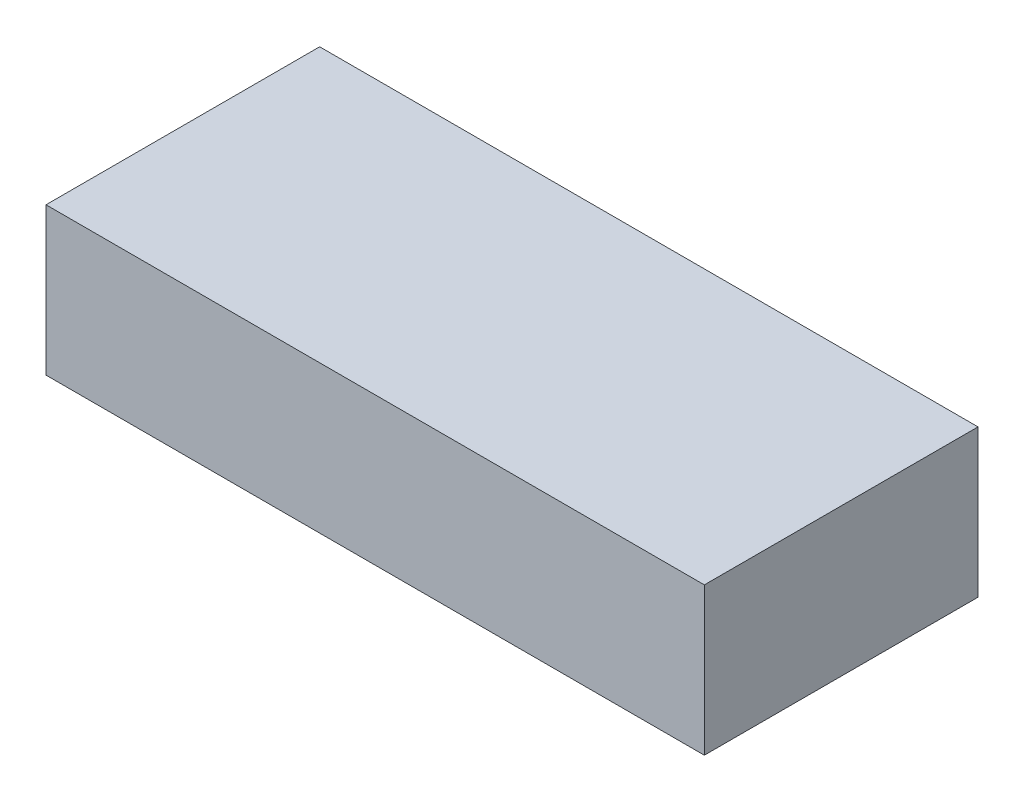
from build123d import *

# Parameters (mm, degrees)
SKETCH1_W           = 83
SKETCH1_H           = 34.5
BOSS_EXTRUDE1_DEPTH = 18.6


with BuildPart() as part:
    # Sketch1 → Boss-Extrude1 (new body)
    with BuildSketch(Plane(origin=(0, 0, 0), x_dir=(1, 0, 0), z_dir=(0, 1, 0))):
        with Locations((41.5, 17.25)):
            Rectangle(SKETCH1_W, SKETCH1_H)
    extrude(amount=BOSS_EXTRUDE1_DEPTH)


solid = part.part
